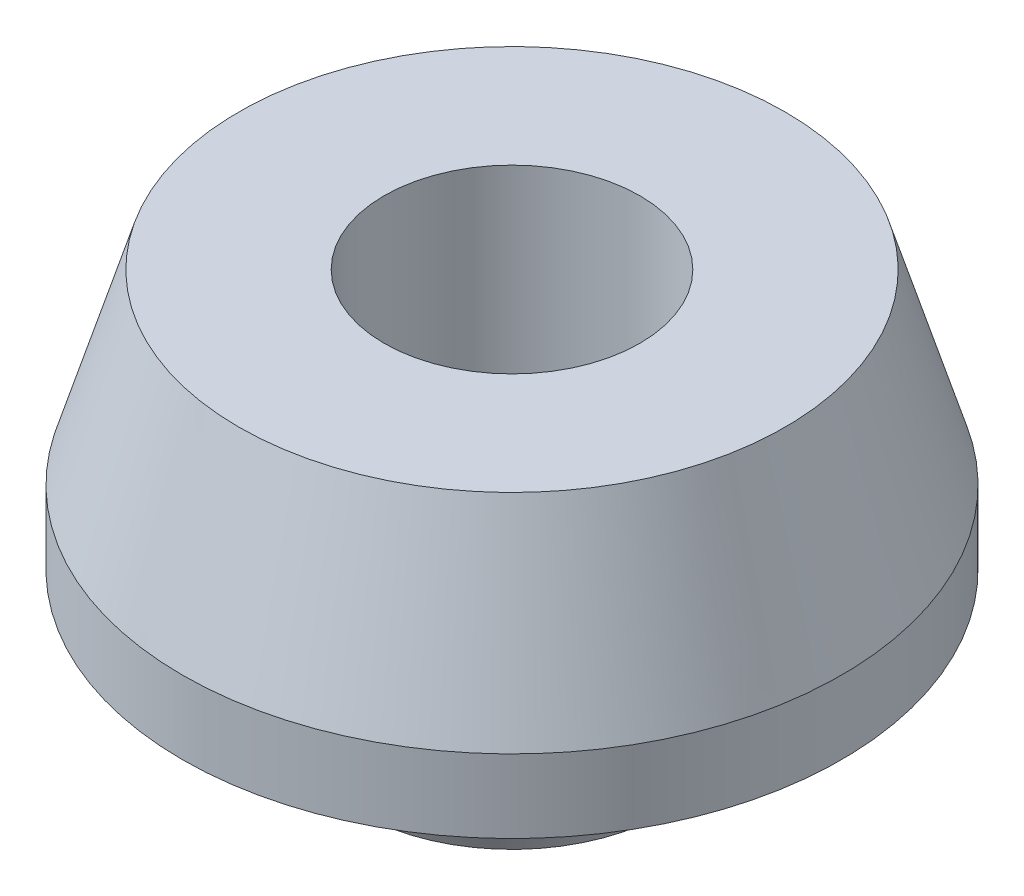
from build123d import *


with BuildPart() as part:
    # Sketch1 → Revolve1 (revolve)
    with BuildSketch(Plane.XY, mode=Mode.PRIVATE) as revolve1_sk:
        Polygon((4.8, 0), (5.8, 0), (7.619851171, 5), (12.369851171, 5), (12.369851171, 7.75), (10.25, 14.75), (4.8, 14.75), align=None)
    revolve(revolve1_sk.sketch.rotate(Axis((0, 17.851444963, 0), (0, -1, 0)), 90), axis=Axis((0, 17.851444963, 0), (0, -1, 0)))


solid = part.part
